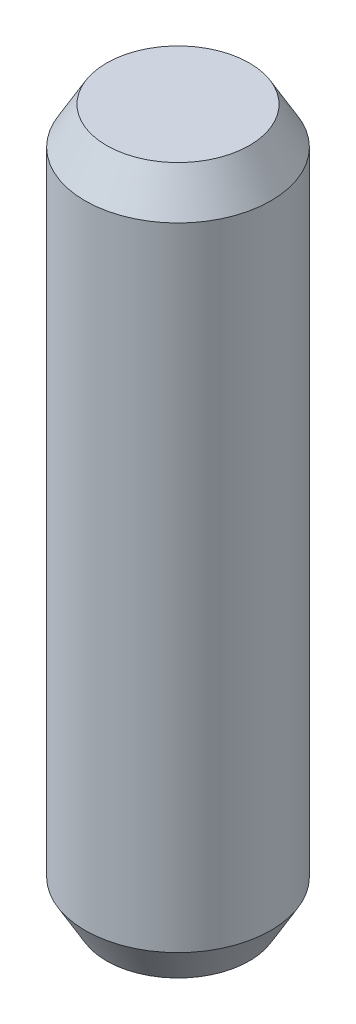
from build123d import *

# Parameters (mm, degrees)
SKETCH1_R           = 3.175
BOSS_EXTRUDE1_DEPTH = 24.13
CHAMFER2_SIZE       = 1.27
CHAMFER2_SIZE2      = 0.733234842


with BuildPart() as part:
    # Sketch1 → Boss-Extrude1 (new body)
    with BuildSketch(Plane(origin=(0, 0, 0), x_dir=(1, 0, 0), z_dir=(0, 1, 0))):
        with Locations(Location((0, 0, 0), (0, 0, 90))):
            Circle(SKETCH1_R)
    extrude(amount=BOSS_EXTRUDE1_DEPTH)

    # Chamfer2
    chamfer2_edges = [part.edges().sort_by_distance(p)[0] for p in [
        (0, 0, 3.175),
        (0, 24.13, 3.175),
    ]]
    chamfer2_side = [part.faces().sort_by_distance(p)[0] for p in [
        (0, 12.065, 3.175),
    ]]
    chamfer(chamfer2_edges, length=CHAMFER2_SIZE, length2=CHAMFER2_SIZE2, reference=chamfer2_side[0])


solid = part.part
